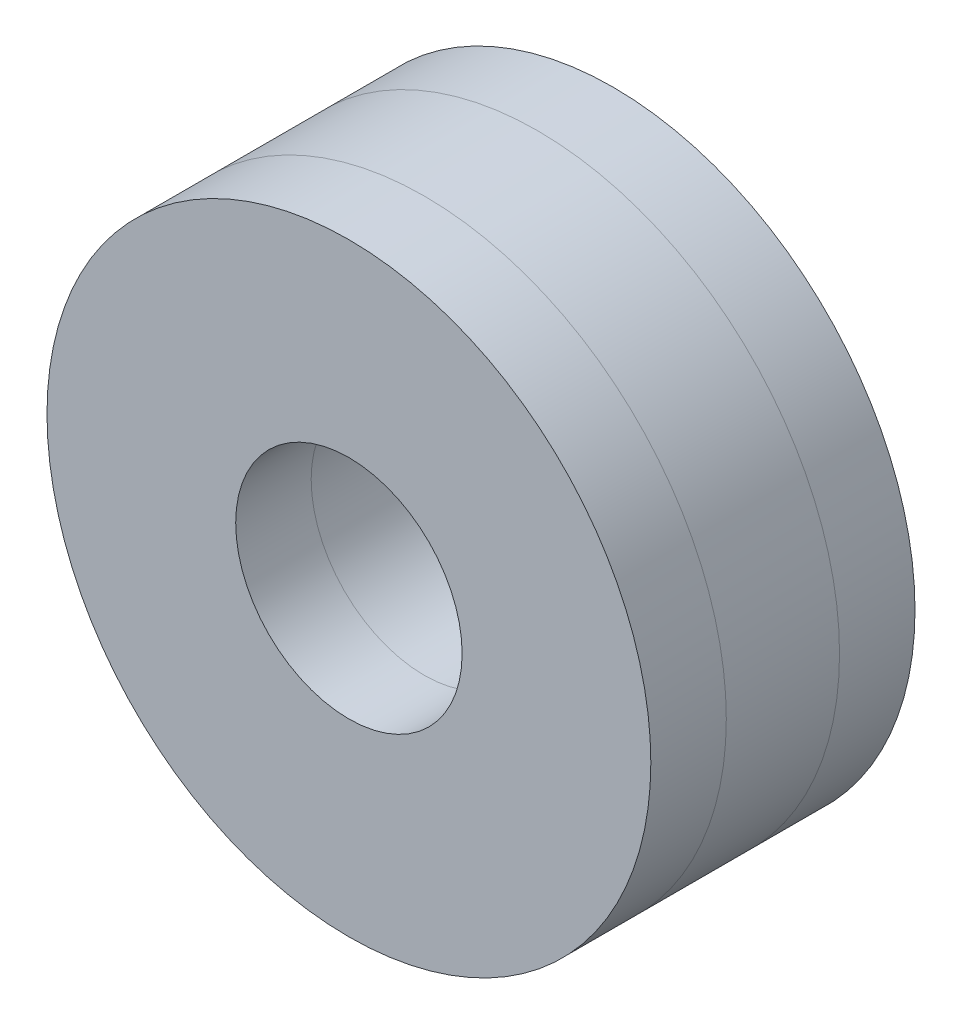
from build123d import *

# Parameters (mm, degrees)
CROQUIS1_R              = 4
CROQUIS1_R_2            = 1.5
SALIENTE_EXTRUIR1_DEPTH = 1
CROQUIS2_R              = 4
CROQUIS2_R_2            = 1.5
SALIENTE_EXTRUIR2_DEPTH = 1.5
CROQUIS3_R              = 4
CROQUIS3_R_2            = 1.5
SALIENTE_EXTRUIR3_DEPTH = 1


with BuildPart() as part:
    # Croquis1 → Saliente-Extruir1 (new body)
    with BuildSketch(Plane.XY):
        Circle(CROQUIS1_R)
        Circle(CROQUIS1_R_2, mode=Mode.SUBTRACT)
    extrude(amount=SALIENTE_EXTRUIR1_DEPTH)


with BuildPart() as body_2:
    # Croquis2 → Saliente-Extruir2 (new body)
    with BuildSketch(Plane.XY.offset(1)):
        Circle(CROQUIS2_R)
        Circle(CROQUIS2_R_2, mode=Mode.SUBTRACT)
    extrude(amount=SALIENTE_EXTRUIR2_DEPTH)


with BuildPart() as body_3:
    # Croquis3 → Saliente-Extruir3 (new body)
    with BuildSketch(Plane.XY.offset(2.5)):
        Circle(CROQUIS3_R)
        Circle(CROQUIS3_R_2, mode=Mode.SUBTRACT)
    extrude(amount=SALIENTE_EXTRUIR3_DEPTH)


solid = Compound([part.part, body_2.part, body_3.part])
